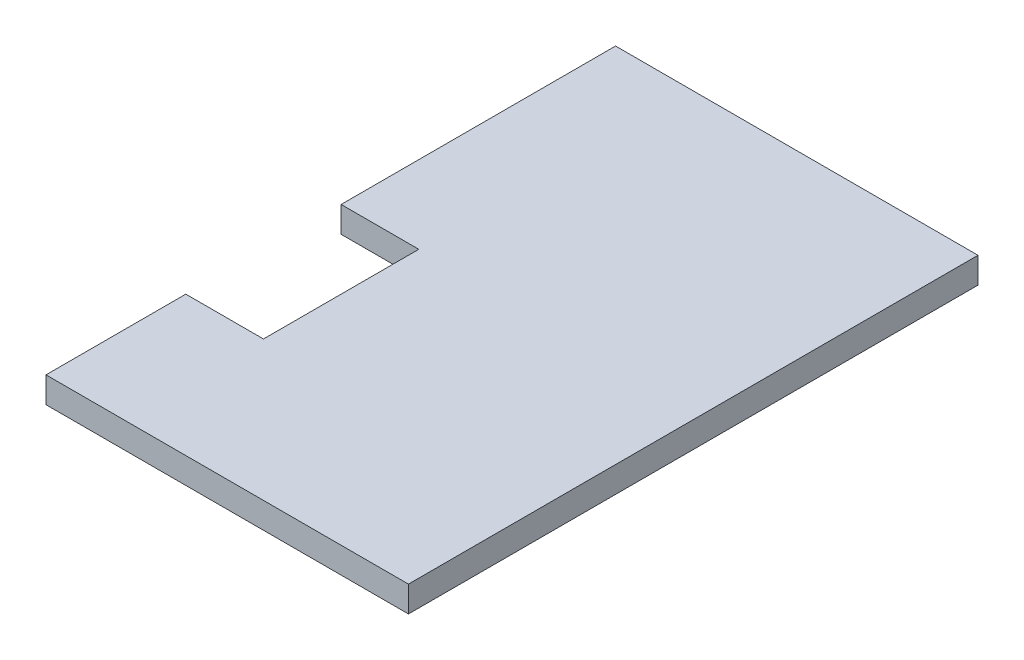
from build123d import *

# Parameters (mm, degrees)
CROQUIS1_W              = 70
CROQUIS1_H              = 110
SALIENTE_EXTRUIR1_DEPTH = 5
CROQUIS2_W              = 15
CROQUIS2_H              = 30
CORTAR_EXTRUIR1_DEPTH   = 99.417594391


with BuildPart() as part:
    # Croquis1 → Saliente-Extruir1 (new body)
    with BuildSketch(Plane(origin=(0, 0, 0), x_dir=(1, 0, 0), z_dir=(0, 1, 0))):
        with Locations((19.079422383, -27.075812274)):
            Rectangle(CROQUIS1_W, CROQUIS1_H)
    extrude(amount=SALIENTE_EXTRUIR1_DEPTH)

    # Croquis2 → Cortar-Extruir1 (cut, through all)
    with BuildSketch(Plane(origin=(0, 5, 0), x_dir=(1, 0, 0), z_dir=(0, 1, 0))):
        with Locations((-8.420577617, -40.075812274)):
            Rectangle(CROQUIS2_W, CROQUIS2_H)
    extrude(amount=-CORTAR_EXTRUIR1_DEPTH, mode=Mode.SUBTRACT)


solid = part.part
